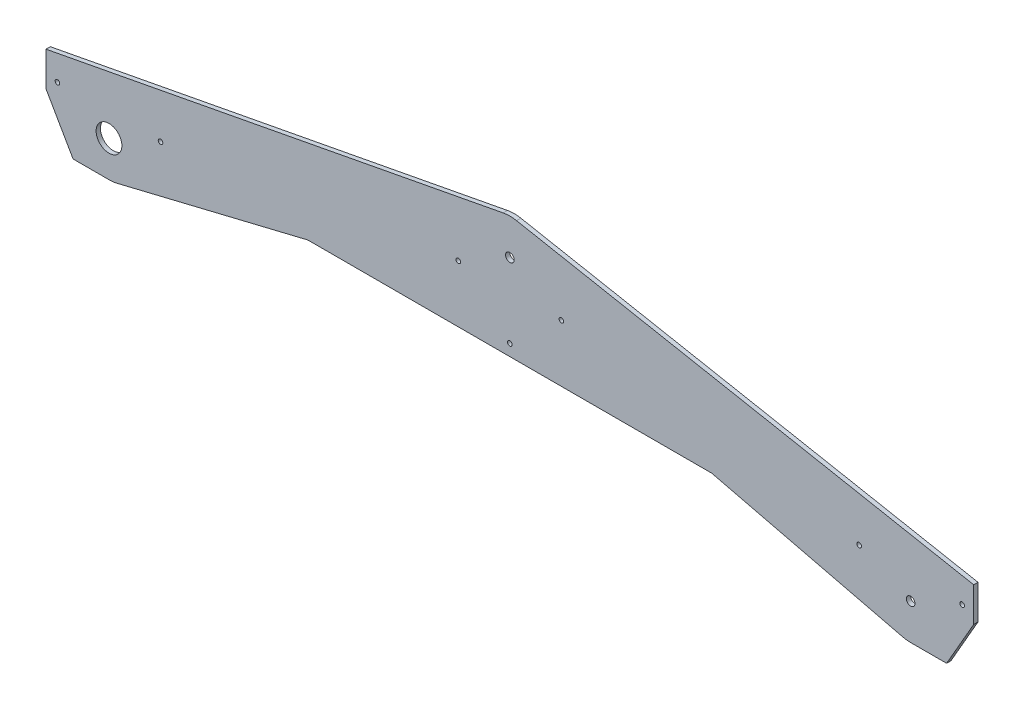
from build123d import *

# Parameters (mm, degrees)
MODEL_R             = 14.2875
MODEL_R_2           = 4.7625
MODEL_R_3           = 2.5527
BOSS_EXTRUDE1_DEPTH = 4.7752


with BuildPart() as part:
    # Model → Boss-Extrude1 (new body)
    with BuildSketch(Plane.XY):
        with BuildLine():
            Line((379.149829152, 1141.15149464), (590.378339475, 1192.375592492))
            Line((590.378339475, 1192.375592492), (814.376062419, 1192.375592492))
            Line((814.376062419, 1192.375592492), (1038.373785363, 1192.375592492))
            Line((1038.373785363, 1192.375592492), (1249.602295686, 1141.15149464))
            ThreePointArc((1249.602295686, 1141.15149464), (1254.256081724, 1140.312171612), (1258.976587117, 1140.031072925))
            Line((1258.976587117, 1140.031072925), (1298.696307446, 1140.031072925))
            Line((1298.696307446, 1140.031072925), (1328.726062419, 1192.375592492))
            Line((1328.726062419, 1192.375592492), (1328.726062419, 1230.475592492))
            Line((1328.726062419, 1230.475592492), (821.794166075, 1326.704151001))
            ThreePointArc((821.794166075, 1326.704151001), (814.376062419, 1327.401992492), (806.957958762, 1326.704151001))
            Line((806.957958762, 1326.704151001), (300.026062419, 1230.475592492))
            Line((300.026062419, 1230.475592492), (300.026062419, 1192.375592492))
            Line((300.026062419, 1192.375592492), (330.055817392, 1140.031072925))
            Line((330.055817392, 1140.031072925), (369.775537721, 1140.031072925))
            ThreePointArc((369.775537721, 1140.031072925), (374.496043114, 1140.312171612), (379.149829152, 1141.15149464))
        make_face()
        with Locations((369.877137721, 1179.807472925)):
            Circle(MODEL_R, mode=Mode.SUBTRACT)
        with Locations((814.376062419, 1287.625592492)):
            Circle(MODEL_R_2, mode=Mode.SUBTRACT)
        with Locations((1258.874987117, 1179.807472925)):
            Circle(MODEL_R_2, mode=Mode.SUBTRACT)
        with Locations((1201.72498751, 1205.075592492)):
            Circle(MODEL_R_3, mode=Mode.SUBTRACT)
        with Locations((1316.024986723, 1205.075592492)):
            Circle(MODEL_R_3, mode=Mode.SUBTRACT)
        with Locations((757.227138115, 1255.875592492)):
            Circle(MODEL_R_3, mode=Mode.SUBTRACT)
        with Locations((871.524986723, 1255.875592492)):
            Circle(MODEL_R_3, mode=Mode.SUBTRACT)
        with Locations((814.376062419, 1205.075592492)):
            Circle(MODEL_R_3, mode=Mode.SUBTRACT)
        with Locations((312.727138115, 1205.075592492)):
            Circle(MODEL_R_3, mode=Mode.SUBTRACT)
        with Locations((427.027137328, 1205.075592492)):
            Circle(MODEL_R_3, mode=Mode.SUBTRACT)
    extrude(amount=BOSS_EXTRUDE1_DEPTH)


solid = part.part
